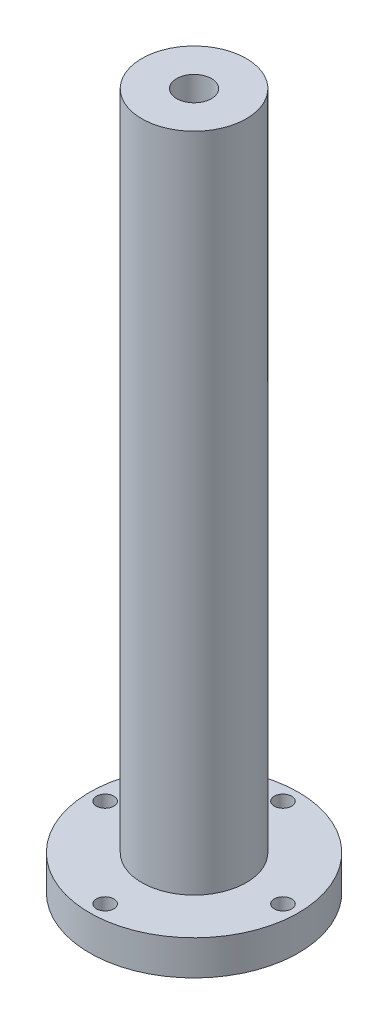
from build123d import *

# Parameters (mm, degrees)
SKETCH5_R          = 25
CUT_EXTRUDE2_DEPTH = 100


with BuildPart() as part:
    # Sketch4 → Revolve2 (revolve)
    with BuildSketch(Plane.XY):
        Polygon((0, -1654.544205968), (300, -1654.544205968), (300, -1554.544205968), (150, -1554.544205968), (150, 345.455794032), (50, 345.455794032), (50, 245.455794032), (0, 245.455794032), align=None)
    revolve(axis=Axis((0, -1654.544205968, 0), (0, 1, 0)))

    # Sketch5 → Cut-Extrude2 (cut)
    with BuildSketch(Plane(origin=(0, -1554.544205968, 0), x_dir=(1, 0, 0), z_dir=(0, 1, 0))):
        with Locations((0, 255.365455535)):
            Circle(SKETCH5_R)
        with Locations((255.365455535, 0)):
            Circle(SKETCH5_R)
        with Locations((0, -255.365455535)):
            Circle(SKETCH5_R)
        with Locations((-255.365455535, 0)):
            Circle(SKETCH5_R)
    extrude(amount=-CUT_EXTRUDE2_DEPTH, mode=Mode.SUBTRACT)


solid = part.part
